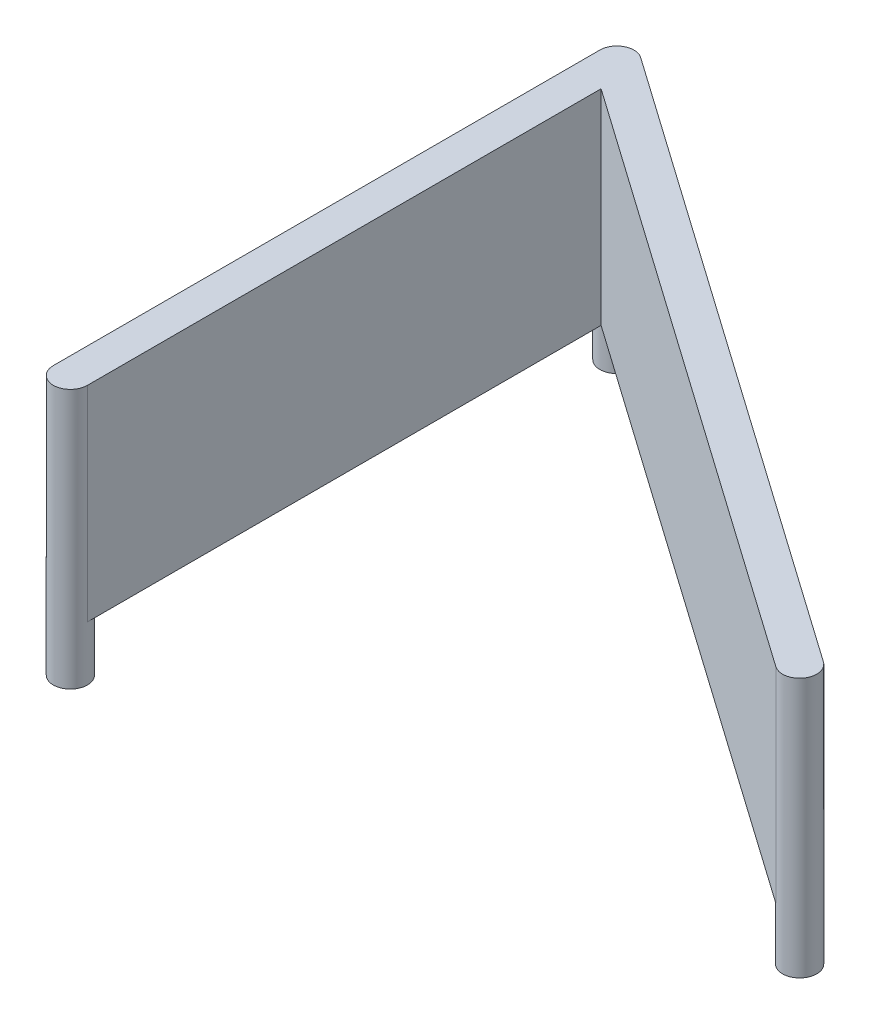
from build123d import *

# Parameters (mm, degrees)
BOSS_EXTRUDE1_DEPTH = 38.1
BOSS_EXTRUDE2_START = 10.16
SKETCH2_R           = 3.175
BOSS_EXTRUDE2_DEPTH = 10.16


with BuildPart() as part:
    # Sketch1 → Boss-Extrude1 (new body)
    with BuildSketch(Plane(origin=(0, 0, 0), x_dir=(1, 0, 0), z_dir=(0, 1, 0))):
        with BuildLine():
            Line((-3.175, 0), (-3.175, 101.6))
            ThreePointArc((-3.175, 101.6), (-1.463672289, 104.417496838), (1.825496649, 104.197727273))
            Line((1.825496649, 104.197727273), (116.125496649, 23.875874704))
            ThreePointArc((116.125496649, 23.875874704), (116.897727273, 19.452650782), (112.474503351, 18.680420159))
            Line((112.474503351, 18.680420159), (3.175, 95.488281873))
            Line((3.175, 95.488281873), (3.175, 0))
            ThreePointArc((3.175, 0), (0, -3.175), (-3.175, 0))
        make_face()
    extrude(amount=BOSS_EXTRUDE1_DEPTH)

    # Sketch2 → Boss-Extrude2 (add)
    with BuildSketch(Plane(origin=(0, 0, 0), x_dir=(-1, 0, 0), z_dir=(0, -1, 0)).offset(BOSS_EXTRUDE2_START)):
        with Locations(Location((0, 0, 0), (0, 0, 90))):
            Circle(SKETCH2_R)
        with Locations(Location((0, 101.6, 0), (0, 0, 90))):
            Circle(SKETCH2_R)
        with Locations(Location((-114.3, 21.278147432, 0), (0, 0, 90))):
            Circle(SKETCH2_R)
    extrude(amount=-BOSS_EXTRUDE2_DEPTH)


solid = part.part
